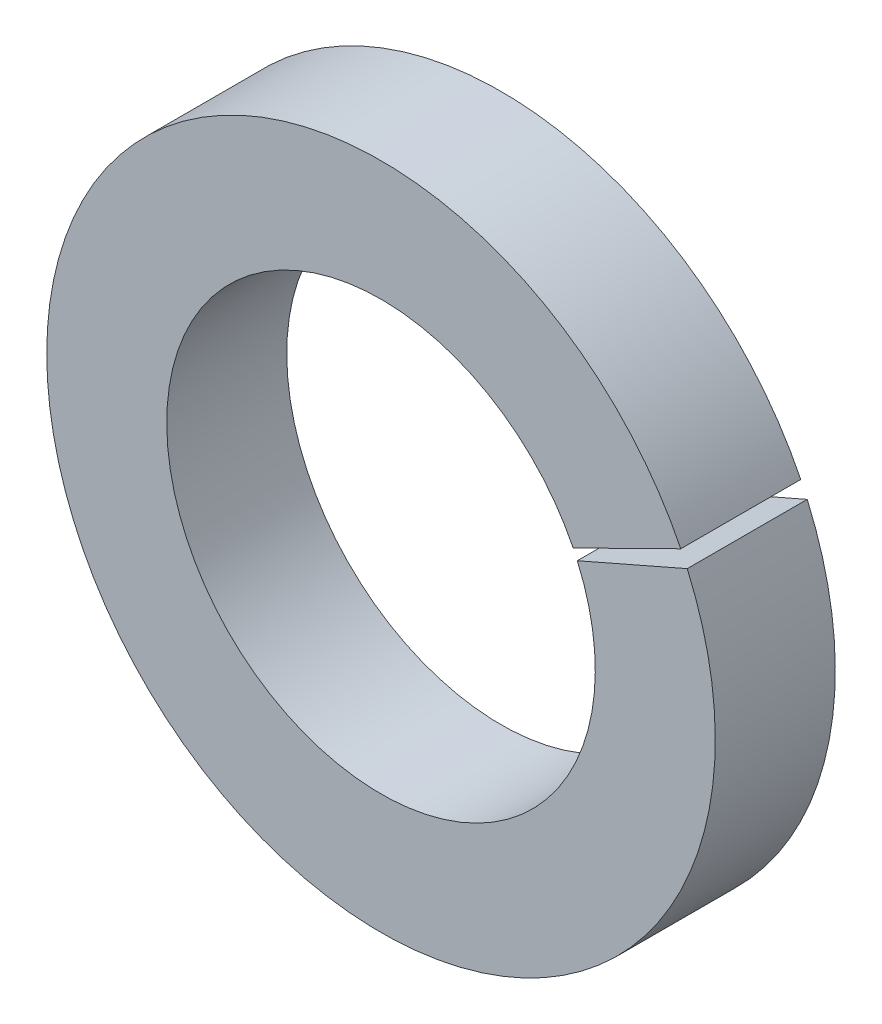
from build123d import *

# Parameters (mm, degrees)
SKETCH_1_R          = 3.9
SKETCH_1_R_2        = 2.5
EXTRUDE_1_DEPTH     = 1.4
CUT_EXTRUDE_1_DEPTH = 10


with BuildPart() as part:
    # 草图1 → 凸台-拉伸1 (new body)
    with BuildSketch(Plane.XY):
        Circle(SKETCH_1_R)
        Circle(SKETCH_1_R_2, mode=Mode.SUBTRACT)
    extrude(amount=EXTRUDE_1_DEPTH)

    # 草图2 → 切除-拉伸1 (cut)
    with BuildSketch(Plane.XY.offset(1.4)):
        Polygon((0, 0), (4.812459265, 2.375572201), (4.812459265, 2.105870497), align=None)
    extrude(amount=-CUT_EXTRUDE_1_DEPTH, mode=Mode.SUBTRACT)


solid = part.part
